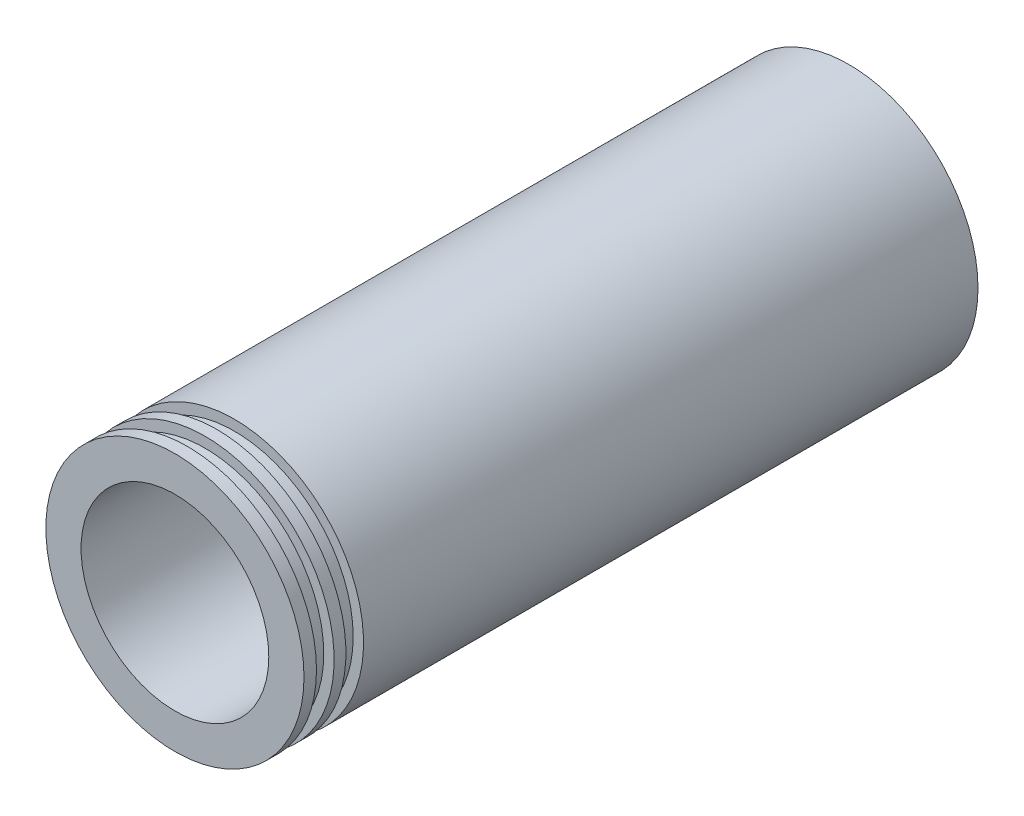
from build123d import *

# Parameters (mm, degrees)
SKETCH1_R           = 34.925
SKETCH1_R_2         = 25.4
BOSS_EXTRUDE1_DEPTH = 182.372


with BuildPart() as part:
    # Sketch1 → Boss-Extrude1 (new body)
    with BuildSketch(Plane.XY):
        Circle(SKETCH1_R)
        Circle(SKETCH1_R_2, mode=Mode.SUBTRACT)
    extrude(amount=BOSS_EXTRUDE1_DEPTH)

    # Cut-Sweep1: sweep along a path in groove path
    with BuildLine(Plane.XY.offset(171.031003689)) as cut_sweep1_path:
        CenterArc((0, 0), 34.925, 0, 360)
    # groove → Cut-Sweep1 (sweep, cut)
    with BuildSketch(Plane(origin=(0, 0, 0), x_dir=(0, 0, -1), z_dir=(1, 0, 0))):
        Polygon((-178.993903689, 34.925), (-178.993903689, 32.131), (-174.231403689, 32.131), (-174.218703689, 34.925), (-171.031003689, 34.925), (-171.031003689, 32.131), (-166.268503689, 32.131), (-166.268503689, 34.925), (-166.268503689, 38.1), (-178.993903689, 38.1), align=None)
    sweep(path=cut_sweep1_path.line, mode=Mode.SUBTRACT)


solid = part.part
